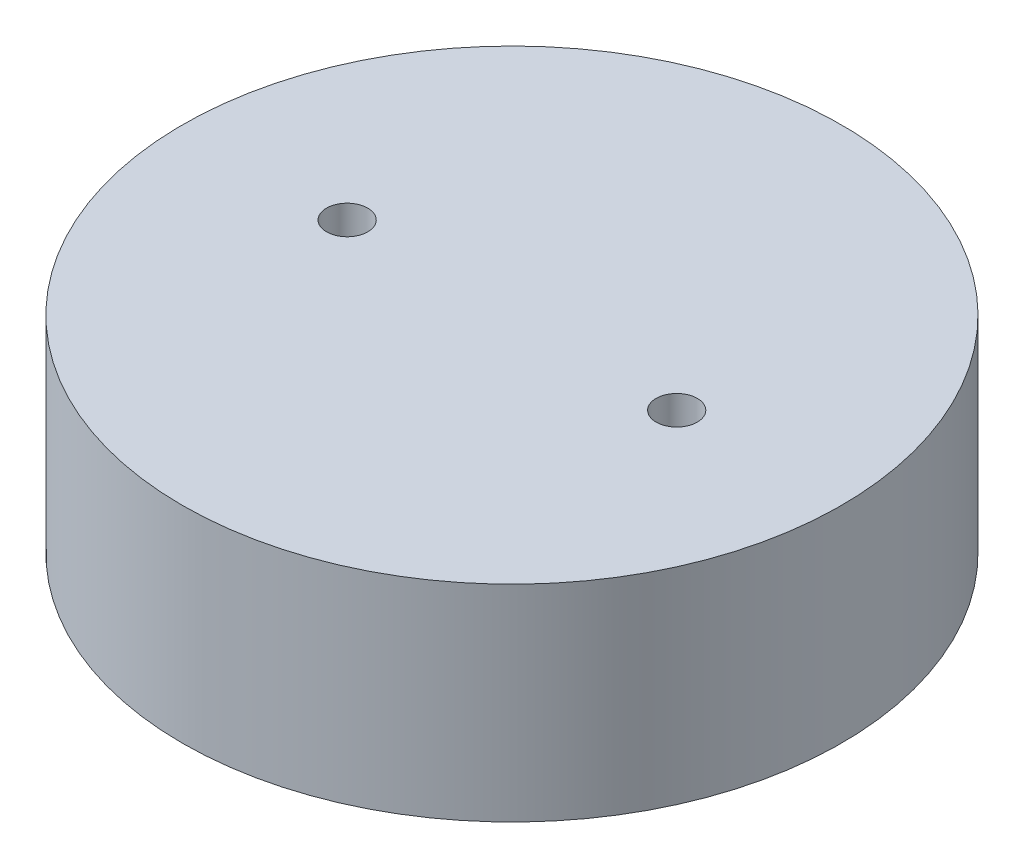
from build123d import *

# Parameters (mm, degrees)
SKETCH1_R           = 40
SKETCH1_R_2         = 2.5
BOSS_EXTRUDE1_DEPTH = 25


with BuildPart() as part:
    # Sketch1 → Boss-Extrude1 (new body)
    with BuildSketch(Plane(origin=(0, 0, 0), x_dir=(1, 0, 0), z_dir=(0, 1, 0))):
        with Locations(Location((0, 0, 0), (0, 0, 270))):
            Circle(SKETCH1_R)
        with Locations(Location((-20, 0, 0), (0, 0, 270))):
            Circle(SKETCH1_R_2, mode=Mode.SUBTRACT)
        with Locations(Location((20, 0, 0), (0, 0, 270))):
            Circle(SKETCH1_R_2, mode=Mode.SUBTRACT)
    extrude(amount=-BOSS_EXTRUDE1_DEPTH)


solid = part.part
